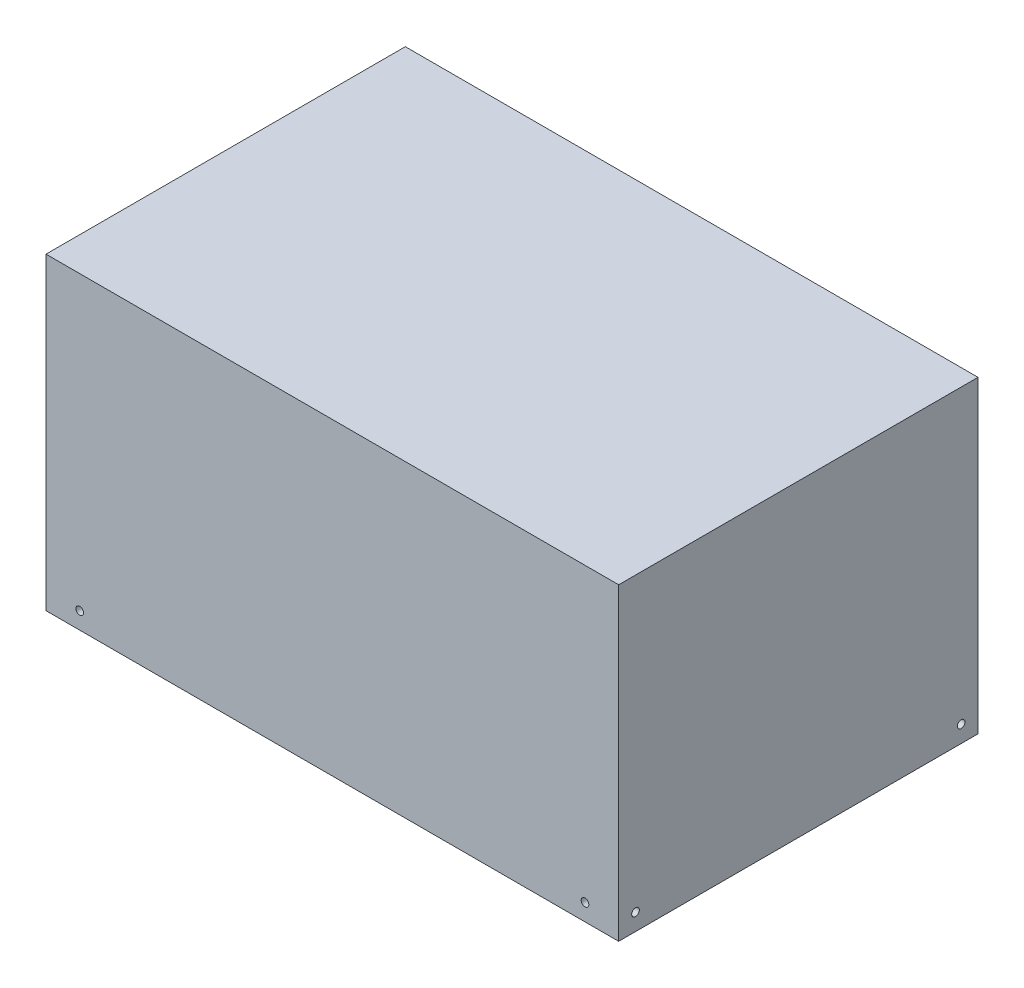
from build123d import *

# Parameters (mm, degrees)
SCHIZZO1_W                     = 510
SCHIZZO1_H                     = 275
ESTRUSIONE_ESTRUSIONE1_DEPTH   = 160
FORO_FILETTATO_M8_1_AT_2_COUNT = 2
FORO_FILETTATO_M8_1_AT_2_PITCH = 450
FORO_FILETTATO_M8_2_D          = 6.8
FORO_FILETTATO_M8_2_DEPTH      = 8.25
FORO_FILETTATO_M8_2_TIP        = 2.042926105


with BuildPart() as part:
    # Schizzo1 → Estrusione-Estrusione1 (new, symmetric)
    with BuildSketch(Plane.XY):
        Rectangle(SCHIZZO1_W, SCHIZZO1_H)
    extrude(amount=ESTRUSIONE_ESTRUSIONE1_DEPTH, both=True)

    # Schizzo4 → Foro filettato M8-1 (revolve, cut)
    with BuildSketch(Plane(origin=(225, -122.5, 160), x_dir=(0, -1, 0), z_dir=(1, 0, 0))):
        Polygon((0, 0), (0, 10.292926105), (3.4, 8.25), (3.4, 0), align=None)
    foro_filettato_m8_1 = revolve(axis=Axis((225, -122.5, 166.35), (0, 0, -1)), mode=Mode.SUBTRACT)

    # Foro filettato M8-1 at 2: Foro filettato M8-1 ×2
    with Locations(*[(-i * FORO_FILETTATO_M8_1_AT_2_PITCH, 0, 0) for i in range(1, FORO_FILETTATO_M8_1_AT_2_COUNT)]):
        add(foro_filettato_m8_1, mode=Mode.SUBTRACT)

    # Foro filettato M8-2
    with Locations(Plane(origin=(255, 0, 0), x_dir=(0, 0, -1), z_dir=(1, 0, 0))):
        with Locations((-145, -122.5), (145, -122.5)):
            Hole(FORO_FILETTATO_M8_2_D / 2, depth=FORO_FILETTATO_M8_2_DEPTH)
            with Locations((0, 0, -(FORO_FILETTATO_M8_2_DEPTH + FORO_FILETTATO_M8_2_TIP / 2))):  # 118° drill point
                Cone(0, FORO_FILETTATO_M8_2_D / 2, FORO_FILETTATO_M8_2_TIP, mode=Mode.SUBTRACT)

    # Specchia1: Foro filettato M8-1 across plane
    add(foro_filettato_m8_1.mirror(Plane.XY), mode=Mode.SUBTRACT)

    # Specchia1 copy 1 sketch → Specchia1 copy 1 (revolve, cut)
    with BuildSketch(Plane(origin=(-225, -122.5, -160), x_dir=(0, -1, 0), z_dir=(1, 0, 0))):
        Polygon((0, 0), (0, -10.292926105), (3.4, -8.25), (3.4, 0), align=None)
    revolve(axis=Axis((-225, -122.5, -166.35), (0, 0, -1)), mode=Mode.SUBTRACT)


solid = part.part
